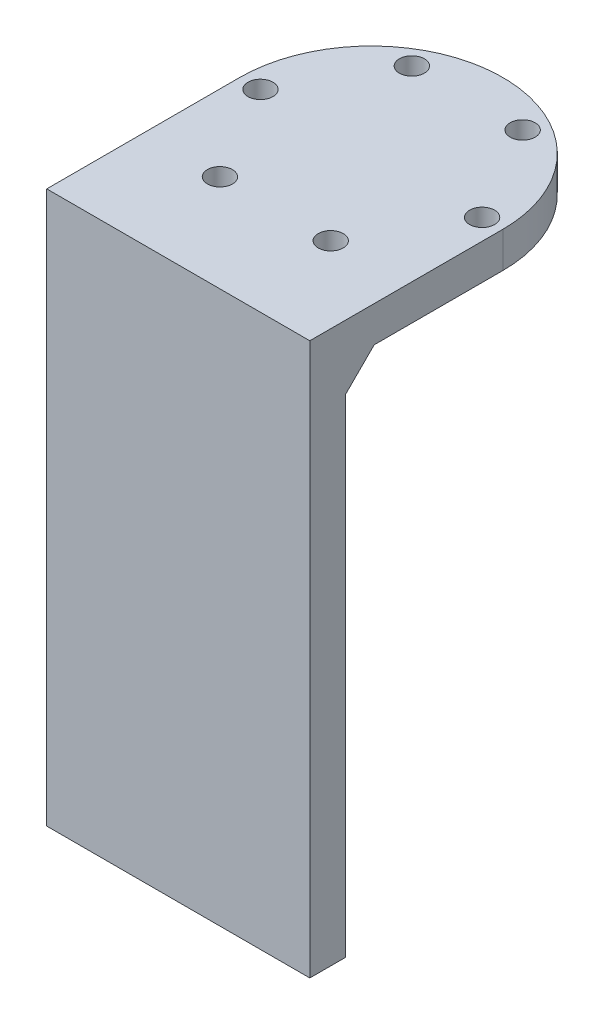
from build123d import *

# Parameters (mm, degrees)
SZKIC2_R                    = 1.75
DODANIE_WYCI_GNI_CIE1_DEPTH = 5
SZKIC3_W                    = 36.8
SZKIC3_H                    = 5
DODANIE_WYCI_GNI_CIE2_DEPTH = 72.2
SFAZOWANIE1_SIZE            = 4


with BuildPart() as part:
    # Szkic2 → Dodanie-wyciągnięcie1 (new body)
    with BuildSketch(Plane.XZ.offset(-37.529198257)):
        with BuildLine():
            Line((76.54438393, 616.406662223), (39.74438393, 616.406662223))
            Line((39.74438393, 616.406662223), (39.74438393, 589.406662223))
            ThreePointArc((39.74438393, 589.406662223), (58.14438393, 571.006662223), (76.54438393, 589.406662223))
            Line((76.54438393, 589.406662223), (76.54438393, 616.406662223))
        make_face()
        with Locations(Location((50.39438393, 575.983268464, 0), (0, 0, 270))):
            Circle(SZKIC2_R, mode=Mode.SUBTRACT)
        with Locations(Location((65.89438393, 575.983268464, 0), (0, 0, 270))):
            Circle(SZKIC2_R, mode=Mode.SUBTRACT)
        with Locations(Location((73.64438393, 589.406662223, 0), (0, 0, 270))):
            Circle(SZKIC2_R, mode=Mode.SUBTRACT)
        with Locations(Location((65.89438393, 602.830055981, 0), (0, 0, 270))):
            Circle(SZKIC2_R, mode=Mode.SUBTRACT)
        with Locations(Location((50.39438393, 602.830055981, 0), (0, 0, 270))):
            Circle(SZKIC2_R, mode=Mode.SUBTRACT)
        with Locations(Location((42.64438393, 589.406662223, 0), (0, 0, 270))):
            Circle(SZKIC2_R, mode=Mode.SUBTRACT)
    extrude(amount=DODANIE_WYCI_GNI_CIE1_DEPTH)

    # Szkic3 → Dodanie-wyciągnięcie2 (add)
    with BuildSketch(Plane.XZ.offset(-32.529198257)):
        with Locations((58.14438393, 613.906662223)):
            Rectangle(SZKIC3_W, SZKIC3_H)
    extrude(amount=DODANIE_WYCI_GNI_CIE2_DEPTH)

    # Sfazowanie1
    sfazowanie1_edges = [part.edges().sort_by_distance(p)[0] for p in [
        (58.14438393, 32.529198257, 611.406662223),
    ]]
    chamfer(sfazowanie1_edges, length=SFAZOWANIE1_SIZE)


solid = part.part
